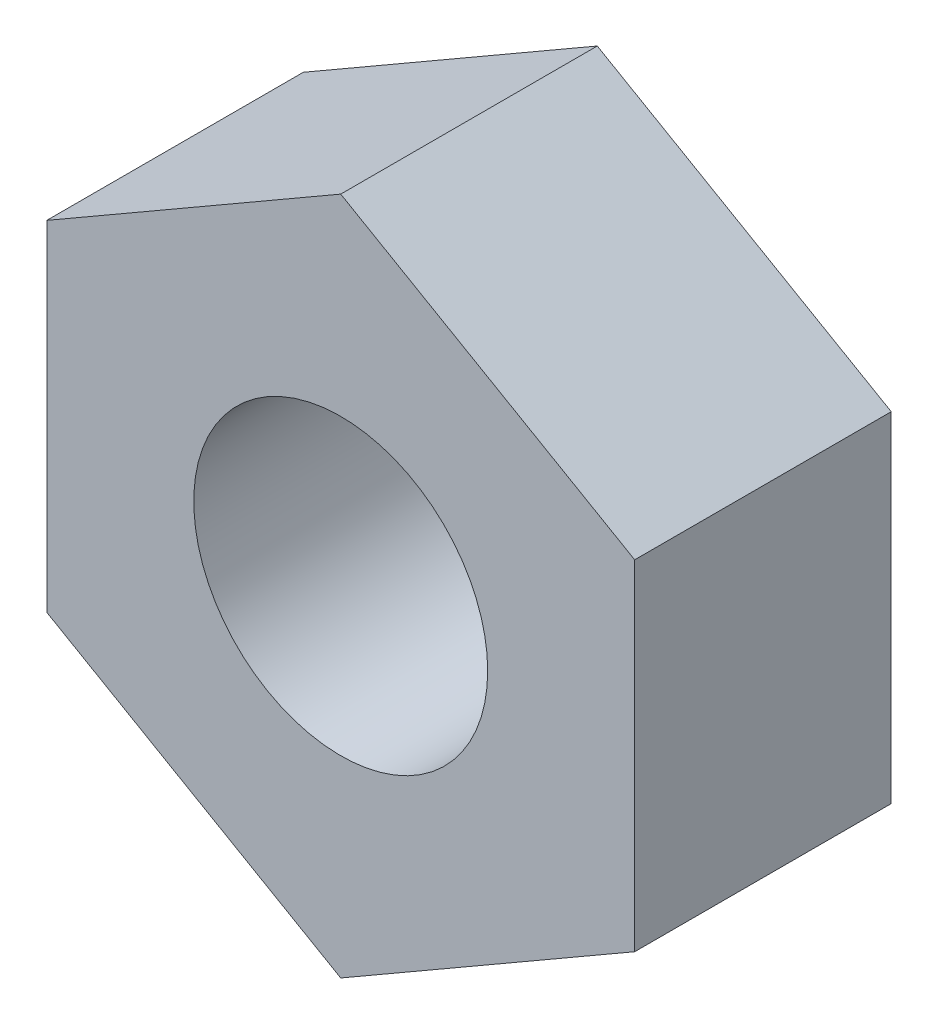
from build123d import *

# Parameters (mm, degrees)
SKETCH1_R           = 1.375
BOSS_EXTRUDE1_DEPTH = 2.4


with BuildPart() as part:
    # Sketch1 → Boss-Extrude1 (new body)
    with BuildSketch(Plane.XY):
        Polygon((2.75, -1.58771324), (2.75, 1.58771324), (0, 3.175426481), (-2.75, 1.58771324), (-2.75, -1.58771324), (0, -3.175426481), align=None)
        Circle(SKETCH1_R, mode=Mode.SUBTRACT)
    extrude(amount=BOSS_EXTRUDE1_DEPTH)


solid = part.part
